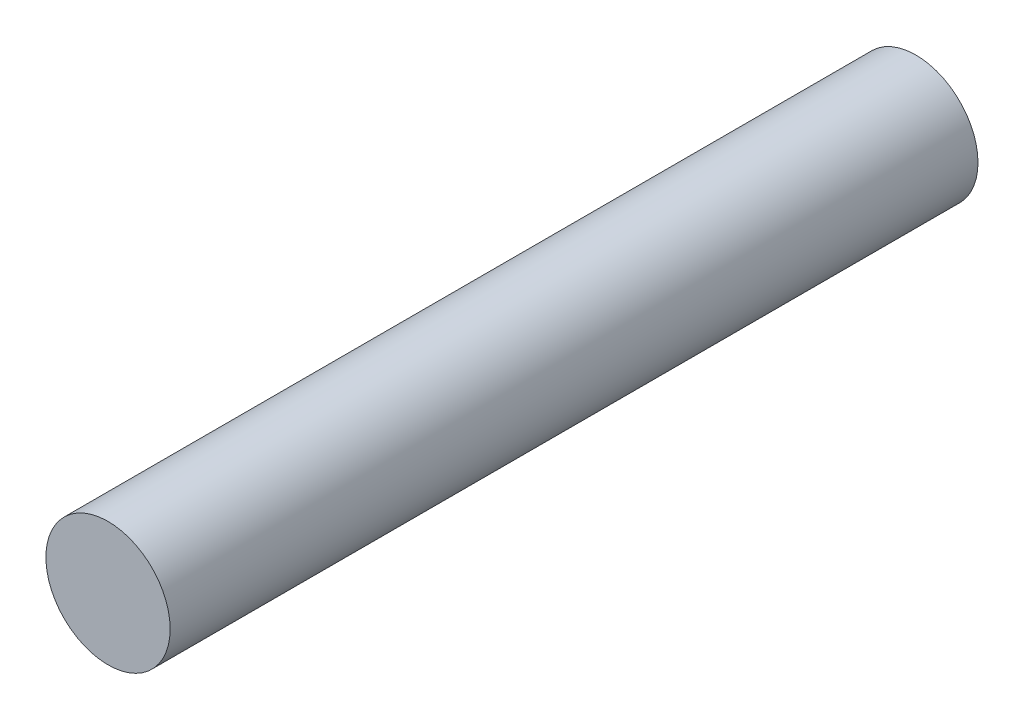
from build123d import *

# Parameters (mm, degrees)
SKETCH1_R           = 2.54
BOSS_EXTRUDE1_DEPTH = 33.02


with BuildPart() as part:
    # Sketch1 → Boss-Extrude1 (new body)
    with BuildSketch(Plane.XY):
        Circle(SKETCH1_R)
    extrude(amount=BOSS_EXTRUDE1_DEPTH)


solid = part.part
